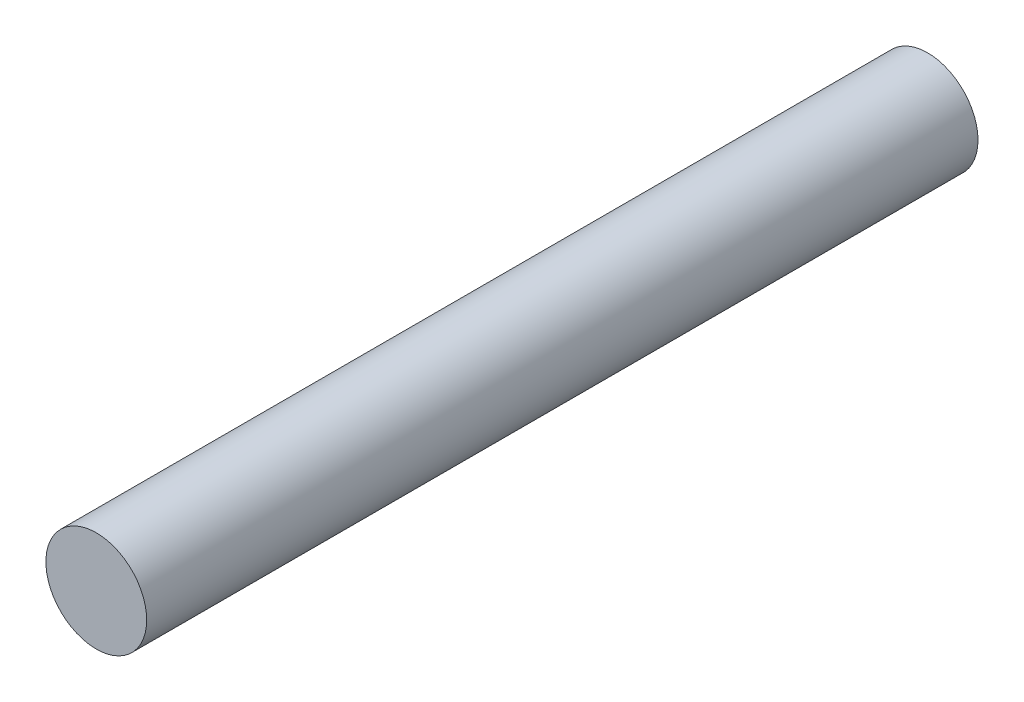
from build123d import *

# Parameters (mm, degrees)
SKETCH_1_R      = 4
EXTRUDE_1_DEPTH = 66


with BuildPart() as part:
    # 草图1 → 凸台-拉伸1 (new body)
    with BuildSketch(Plane.XY):
        Circle(SKETCH_1_R)
    extrude(amount=EXTRUDE_1_DEPTH)


solid = part.part
